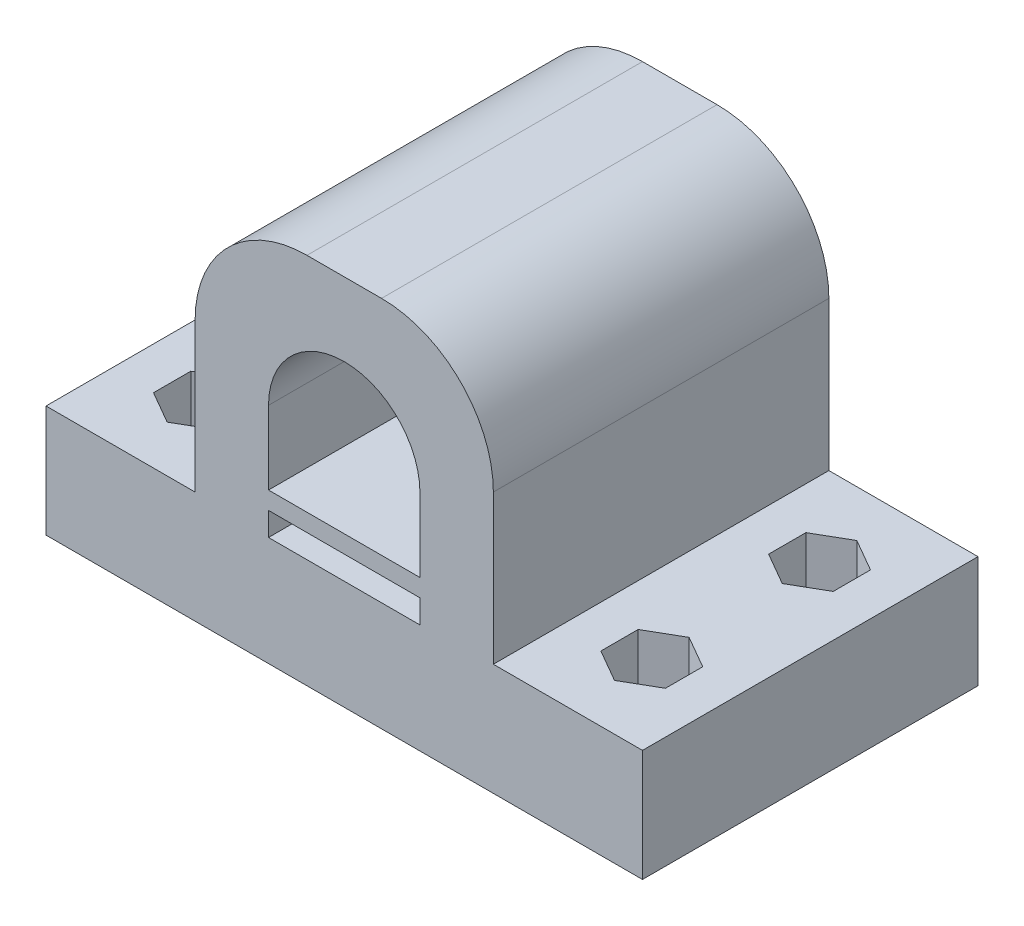
from build123d import *

# Parameters (mm, degrees)
SKETCH1_W           = 50.8
SKETCH1_H           = 28.575
BOSS_EXTRUDE1_DEPTH = 31.75
SKETCH2_W           = 12.7
SKETCH2_H           = 22.225
SKETCH2_W_2         = 12.9
SKETCH2_H_2         = 2
CUT_EXTRUDE1_DEPTH  = 28.575
FILLET2_R           = 9.525
CUT_EXTRUDE2_REACH  = 45.097


with BuildPart() as part:
    # Sketch1 → Boss-Extrude1 (new body)
    with BuildSketch(Plane(origin=(0, 0, 0), x_dir=(1, 0, 0), z_dir=(0, 1, 0))):
        Rectangle(SKETCH1_W, SKETCH1_H)
    extrude(amount=BOSS_EXTRUDE1_DEPTH)

    # Sketch2 → Cut-Extrude1 (cut)
    with BuildSketch(Plane.XY.offset(14.2875)):
        with Locations((-19.05, 20.6375)):
            Rectangle(SKETCH2_W, SKETCH2_H)
        with BuildLine():
            Line((6.45, 12.8), (6.45, 19.05))
            ThreePointArc((6.45, 19.05), (0, 25.5), (-6.45, 19.05))
            Line((-6.45, 19.05), (-6.45, 12.8))
            Line((-6.45, 12.8), (6.45, 12.8))
        make_face()
        with Locations((0, 10.3)):
            Rectangle(SKETCH2_W_2, SKETCH2_H_2)
        with Locations((19.05, 20.6375)):
            Rectangle(SKETCH2_W, SKETCH2_H)
    extrude(amount=-CUT_EXTRUDE1_DEPTH, mode=Mode.SUBTRACT)

    # Fillet2
    fillet2_edges = [part.edges().sort_by_distance(p)[0] for p in [
        (-12.7, 31.75, 0),
        (12.7, 31.75, 0),
    ]]
    fillet(fillet2_edges, radius=FILLET2_R)

    # Sketch9 → Cut-Extrude2 (cut, up to next)
    with BuildSketch(Plane.XZ, mode=Mode.PRIVATE) as cut_extrude2_sk1:
        Polygon((16.3, -5.55603676), (16.3, -8.73146324), (19.05, -10.319176481), (21.8, -8.73146324), (21.8, -5.55603676), (19.05, -3.968323519), align=None)
    cut_extrude2_tool1 = extrude(cut_extrude2_sk1.sketch, amount=-CUT_EXTRUDE2_REACH, mode=Mode.PRIVATE) & part.part
    # Sketch9 → Cut-Extrude2 (cut, up to next)
    with BuildSketch(Plane.XZ, mode=Mode.PRIVATE) as cut_extrude2_sk2:
        Polygon((16.3, 5.55603676), (19.05, 3.968323519), (21.8, 5.55603676), (21.8, 8.73146324), (19.05, 10.319176481), (16.3, 8.73146324), align=None)
    cut_extrude2_tool2 = extrude(cut_extrude2_sk2.sketch, amount=-CUT_EXTRUDE2_REACH, mode=Mode.PRIVATE) & part.part
    # Sketch9 → Cut-Extrude2 (cut, up to next)
    with BuildSketch(Plane.XZ, mode=Mode.PRIVATE) as cut_extrude2_sk3:
        Polygon((-16.3, -8.73146324), (-16.3, -5.55603676), (-19.05, -3.968323519), (-21.8, -5.55603676), (-21.8, -8.73146324), (-19.05, -10.319176481), align=None)
    cut_extrude2_tool3 = extrude(cut_extrude2_sk3.sketch, amount=-CUT_EXTRUDE2_REACH, mode=Mode.PRIVATE) & part.part
    # Sketch9 → Cut-Extrude2 (cut, up to next)
    with BuildSketch(Plane.XZ, mode=Mode.PRIVATE) as cut_extrude2_sk4:
        Polygon((-16.3, 5.55603676), (-16.3, 8.73146324), (-19.05, 10.319176481), (-21.8, 8.73146324), (-21.8, 5.55603676), (-19.05, 3.968323519), align=None)
    cut_extrude2_tool4 = extrude(cut_extrude2_sk4.sketch, amount=-CUT_EXTRUDE2_REACH, mode=Mode.PRIVATE) & part.part
    add(cut_extrude2_tool1.solids().sort_by_distance((19.05, 0, -7.14375))[0], mode=Mode.SUBTRACT)
    add(cut_extrude2_tool2.solids().sort_by_distance((19.05, 0, 7.14375))[0], mode=Mode.SUBTRACT)
    add(cut_extrude2_tool3.solids().sort_by_distance((-19.05, 0, -7.14375))[0], mode=Mode.SUBTRACT)
    add(cut_extrude2_tool4.solids().sort_by_distance((-19.05, 0, 7.14375))[0], mode=Mode.SUBTRACT)


solid = part.part
